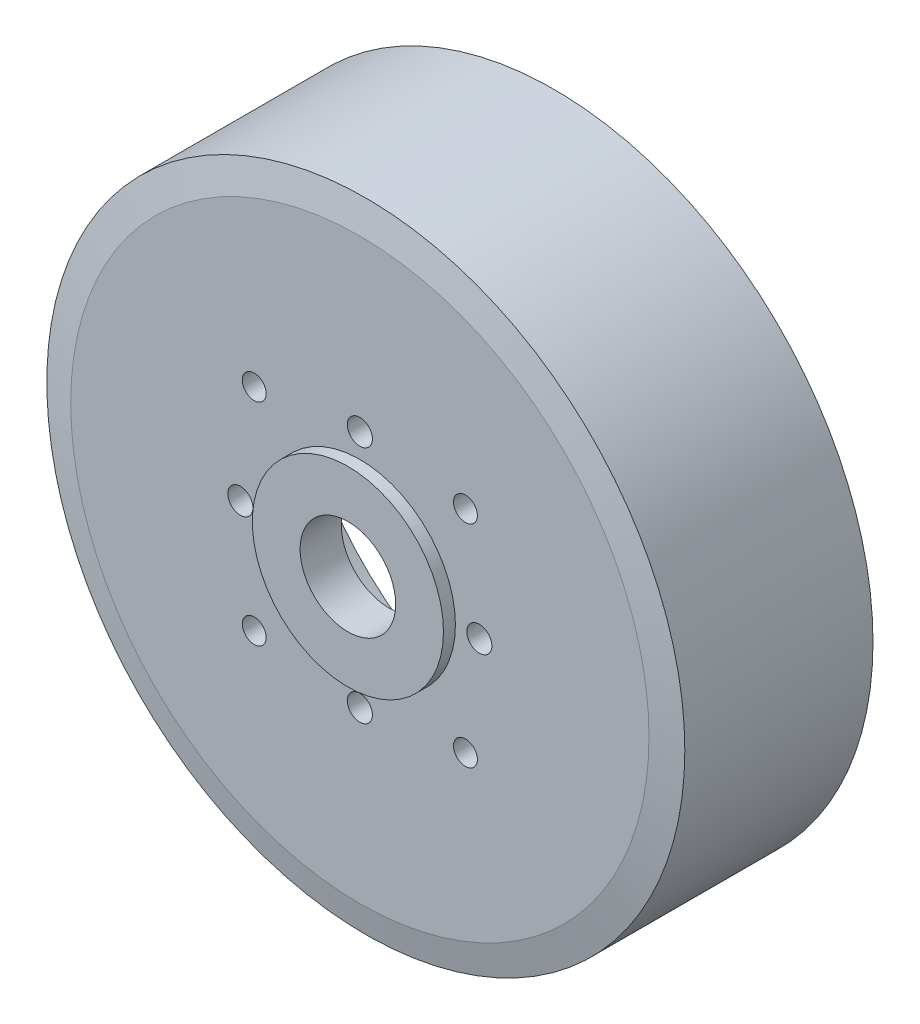
from build123d import *

# Parameters (mm, degrees)
SKETCH3_R           = 53.4
BOSS_EXTRUDE1_DEPTH = 38.5
SKETCH4_R           = 8
CUT_EXTRUDE1_DEPTH  = 85.766561804
SKETCH5_R           = 2
CUT_EXTRUDE2_DEPTH  = 20
BOSS_EXTRUDE3_START = 2
SKETCH6_R           = 16
SKETCH6_R_2         = 8
BOSS_EXTRUDE3_DEPTH = 2
SKETCH7_R           = 2.1
CUT_EXTRUDE3_DEPTH  = 20
SKETCH8_R           = 2.5
CUT_EXTRUDE4_DEPTH  = 20
CHAMFER1_SIZE       = 1
CHAMFER1_SIZE2      = 5
CUT_EXTRUDE5_START  = -6
SKETCH9_R           = 53.4
CUT_EXTRUDE5_DEPTH  = 6
SKETCH10_R          = 44.75
CUT_EXTRUDE6_DEPTH  = 27.6


with BuildPart() as part:
    # Sketch3 → Boss-Extrude1 (new body)
    with BuildSketch(Plane.XY):
        Circle(SKETCH3_R)
    extrude(amount=-BOSS_EXTRUDE1_DEPTH)

    # Sketch4 → Cut-Extrude1 (cut, through all)
    with BuildSketch(Plane.XY):
        Circle(SKETCH4_R)
    extrude(amount=-CUT_EXTRUDE1_DEPTH, mode=Mode.SUBTRACT)

    # Sketch5 → Cut-Extrude2 (cut)
    with BuildSketch(Plane.XY):
        with Locations((-17.67766953, 17.67766953)):
            Circle(SKETCH5_R)
        with Locations((17.67766953, 17.67766953)):
            Circle(SKETCH5_R)
        with Locations((-17.67766953, -17.67766953)):
            Circle(SKETCH5_R)
        with Locations((17.67766953, -17.67766953)):
            Circle(SKETCH5_R)
    extrude(amount=-CUT_EXTRUDE2_DEPTH, mode=Mode.SUBTRACT)

    # Sketch6 → Boss-Extrude3 (add)
    with BuildSketch(Plane.XY.offset(BOSS_EXTRUDE3_START)):
        Circle(SKETCH6_R)
        Circle(SKETCH6_R_2, mode=Mode.SUBTRACT)
    extrude(amount=-BOSS_EXTRUDE3_DEPTH)

    # Sketch7 → Cut-Extrude3 (cut)
    with BuildSketch(Plane.XY):
        with Locations((0, 20)):
            Circle(SKETCH7_R)
        with Locations((20, 0)):
            Circle(SKETCH7_R)
        with Locations((-20, 0)):
            Circle(SKETCH7_R)
        with Locations((0, -20)):
            Circle(SKETCH7_R)
    extrude(amount=-CUT_EXTRUDE3_DEPTH, mode=Mode.SUBTRACT)

    # Sketch8 → Cut-Extrude4 (cut)
    with BuildSketch(Plane(origin=(0, 0, -38.5), x_dir=(-1, 0, 0), z_dir=(0, 0, -1))):
        with Locations((0, 30)):
            Circle(SKETCH8_R)
        with Locations((30, 0)):
            Circle(SKETCH8_R)
        with Locations((0, -30)):
            Circle(SKETCH8_R)
        with Locations((-30, 0)):
            Circle(SKETCH8_R)
    extrude(amount=-CUT_EXTRUDE4_DEPTH, mode=Mode.SUBTRACT)

    # Chamfer1
    chamfer1_edges = [part.edges().sort_by_distance(p)[0] for p in [
        (-53.4, 0, 0),
    ]]
    chamfer1_side = [part.faces().sort_by_distance(p)[0] for p in [
        (-53.4, 0, -19.25),
    ]]
    chamfer(chamfer1_edges, length=CHAMFER1_SIZE, length2=CHAMFER1_SIZE2, reference=chamfer1_side[0])

    # Sketch9 → Cut-Extrude5 (cut)
    with BuildSketch(Plane(origin=(0, 0, -38.5), x_dir=(-1, 0, 0), z_dir=(0, 0, -1)).offset(CUT_EXTRUDE5_START)):
        with Locations(Location((0, 0, 0), (0, 0, 180))):
            Circle(SKETCH9_R)
    extrude(amount=CUT_EXTRUDE5_DEPTH, mode=Mode.SUBTRACT)

    # Sketch10 → Cut-Extrude6 (cut)
    with BuildSketch(Plane(origin=(0, 0, -32.5), x_dir=(-1, 0, 0), z_dir=(0, 0, -1))):
        Circle(SKETCH10_R)
    extrude(amount=-CUT_EXTRUDE6_DEPTH, mode=Mode.SUBTRACT)


solid = part.part
